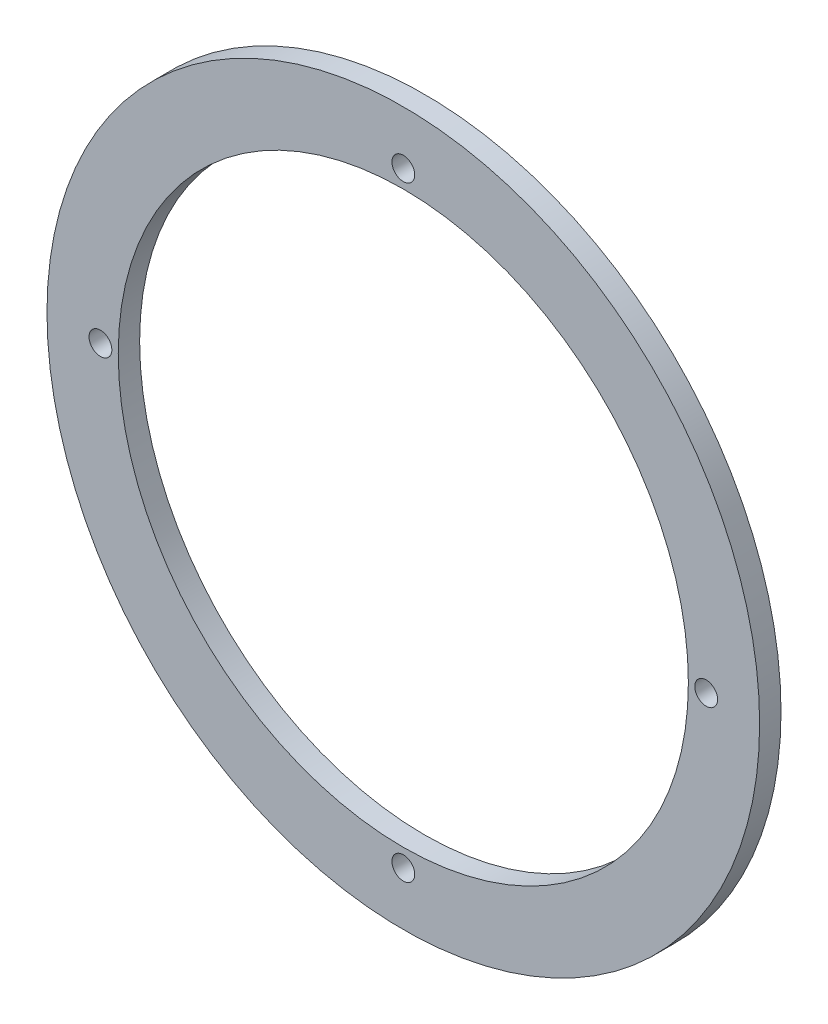
from build123d import *

# Parameters (mm, degrees)
SKETCH_1_R      = 50
SKETCH_1_R_2    = 40
SKETCH_1_R_3    = 1.6
EXTRUDE_1_DEPTH = 3


with BuildPart() as part:
    # 草图1 → 凸台-拉伸1 (new body)
    with BuildSketch(Plane.XY):
        Circle(SKETCH_1_R)
        Circle(SKETCH_1_R_2, mode=Mode.SUBTRACT)
        with Locations((0, 42.5)):
            Circle(SKETCH_1_R_3, mode=Mode.SUBTRACT)
        with Locations((42.5, 0)):
            Circle(SKETCH_1_R_3, mode=Mode.SUBTRACT)
        with Locations((0, -42.5)):
            Circle(SKETCH_1_R_3, mode=Mode.SUBTRACT)
        with Locations((-42.5, 0)):
            Circle(SKETCH_1_R_3, mode=Mode.SUBTRACT)
    extrude(amount=EXTRUDE_1_DEPTH)


solid = part.part
